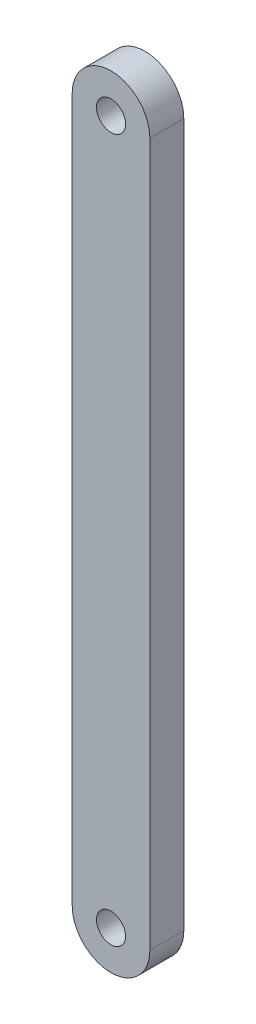
from build123d import *

# Parameters (mm, degrees)
SKETCH1_R           = 1.5
BOSS_EXTRUDE1_DEPTH = 3.5


with BuildPart() as part:
    # Sketch1 → Boss-Extrude1 (new body)
    with BuildSketch(Plane.XY):
        with BuildLine():
            Line((-4, 72.5), (-4, 0))
            ThreePointArc((-4, 0), (0, -4), (4, 0))
            Line((4, 0), (4, 72.5))
            ThreePointArc((4, 72.5), (0, 76.5), (-4, 72.5))
        make_face()
        with Locations((0, 72.5)):
            Circle(SKETCH1_R, mode=Mode.SUBTRACT)
        Circle(SKETCH1_R, mode=Mode.SUBTRACT)
    extrude(amount=BOSS_EXTRUDE1_DEPTH)


solid = part.part
